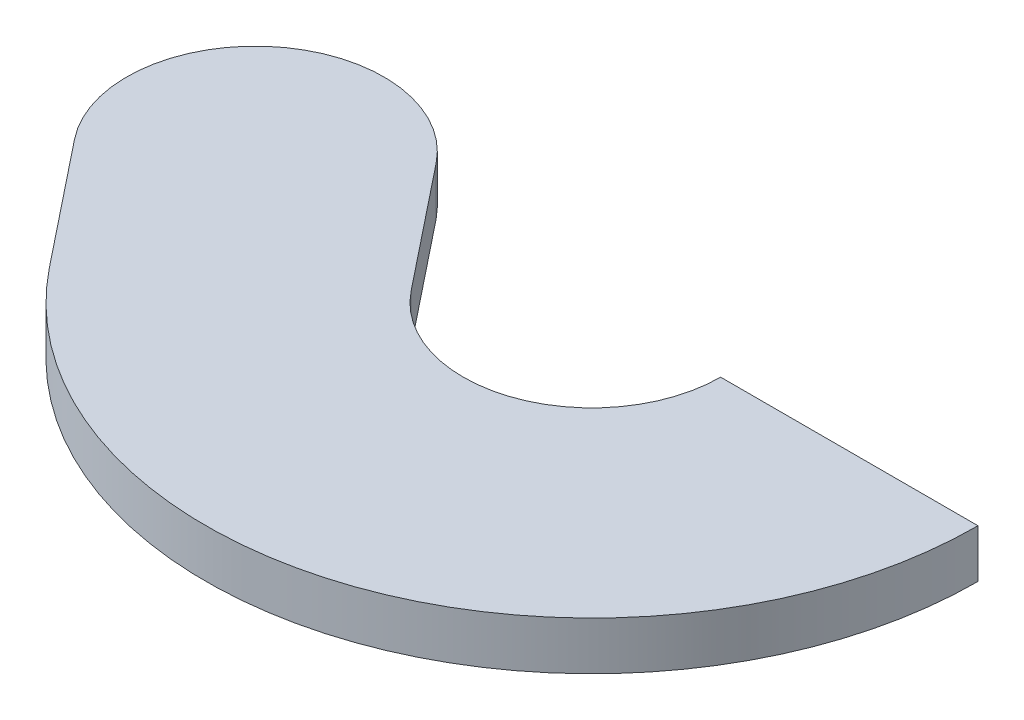
from build123d import *

# Parameters (mm, degrees)
BOSS_EXTRUDE1_DEPTH = 9.525


with BuildPart() as part:
    # Sketch3 → Boss-Extrude1 (new, symmetric)
    with BuildSketch(Plane(origin=(0, 0, 0), x_dir=(1, 0, 0), z_dir=(0, 1, 0))):
        with BuildLine():
            Line((-39.728936037, -31.65835816), (-78.552476961, 17.06236091))
            ThreePointArc((-78.552476961, 17.06236091), (-149.939771158, 25.132938787), (-158.010349035, -46.25435541))
            Line((-158.010349035, -46.25435541), (-119.186808111, -94.97507448))
            ThreePointArc((-119.186808111, -94.97507448), (50.307506616, -143.857272246), (152.4, 0))
            Line((152.4, 0), (50.8, 0))
            ThreePointArc((50.8, 0), (16.769168872, -47.952424082), (-39.728936037, -31.65835816))
        make_face()
    extrude(amount=BOSS_EXTRUDE1_DEPTH, both=True)


solid = part.part
